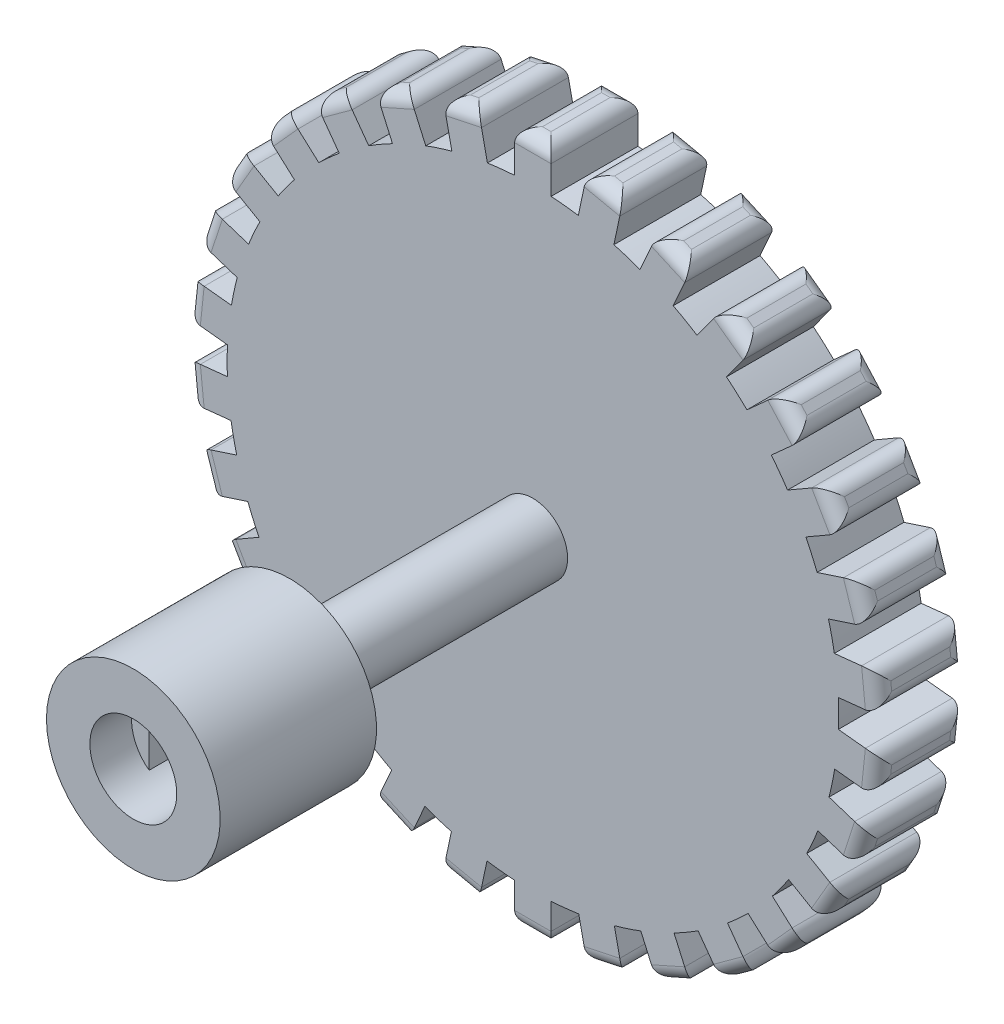
from build123d import *

# Parameters (mm, degrees)
SKETCH1_R                = 88
BOSS_EXTRUDE3_DEPTH      = 25
SKETCH4_W                = 10.4719
SKETCH4_H                = 13.351164338
BOSS_EXTRUDE4_DEPTH      = 25
FILLET2_R                = 4
CIRPATTERN1_COUNT        = 30
FILLET2_OF_CIRPATTERN1_R = 4
SKETCH6_R                = 10
BOSS_EXTRUDE5_DEPTH      = 60
BOSS_EXTRUDE6_START      = 10
SKETCH7_R                = 10
BOSS_EXTRUDE6_DEPTH      = 10
SKETCH8_R                = 10
BOSS_EXTRUDE7_DEPTH      = 10
SKETCH9_R                = 10
BOSS_EXTRUDE8_DEPTH      = 25
SKETCH10_R               = 10
BOSS_EXTRUDE9_DEPTH      = 42.5
SKETCH12_R               = 12.5
CUT_EXTRUDE1_DEPTH       = 12
CUT_EXTRUDE2_START       = -55.5
SKETCH13_R               = 10
CUT_EXTRUDE2_DEPTH       = 55.5
SKETCH14_R               = 25
BOSS_EXTRUDE10_DEPTH     = 45
SKETCH15_R               = 12.5
CUT_EXTRUDE3_DEPTH       = 12
CUT_EXTRUDE4_DEPTH       = 30.5
SCALE1_SCALE             = 0.2


with BuildPart() as part:
    # Sketch1 → Boss-Extrude3 (new body)
    with BuildSketch(Plane.XY):
        Circle(SKETCH1_R)
    extrude(amount=BOSS_EXTRUDE3_DEPTH)

    # Sketch4 → Boss-Extrude4 (add)
    with BuildSketch(Plane.XY.offset(25)):
        with Locations((0, 93.324417831)):
            Rectangle(SKETCH4_W, SKETCH4_H)
    boss_extrude4 = extrude(amount=-BOSS_EXTRUDE4_DEPTH)

    # Fillet2
    fillet2_edges = [part.edges().sort_by_distance(p)[0] for p in [
        (5.23595, 100, 12.5),
        (0, 100, 0),
        (-5.23595, 100, 12.5),
        (0, 100, 25),
    ]]
    fillet(fillet2_edges, radius=FILLET2_R)

    # CirPattern1: Boss-Extrude4 ×30 about axis
    cirpattern1_axis = Axis((0, 0.317667884, 0), (0, 0, 1))
    for i in range(1, CIRPATTERN1_COUNT):
        add(boss_extrude4.rotate(cirpattern1_axis, i * 360 / CIRPATTERN1_COUNT))

    # Fillet2 of CirPattern1
    fillet2_of_cirpattern1_edges = [part.edges().sort_by_distance(p)[0] for p in [
        (-15.603590285, 98.910317096, 12.5),
        (-20.725122215, 97.821701879, 0),
        (-25.846654145, 96.733086661, 12.5),
        (-20.725122215, 97.821701879, 25),
        (-35.7611788, 93.511662322, 12.5),
        (-40.544457139, 91.382009596, 0),
        (-45.327735478, 89.252356869, 12.5),
        (-40.544457139, 91.382009596, 25),
        (-54.3558322, 84.039982796, 12.5),
        (-58.591804732, 80.962368605, 0),
        (-62.827777264, 77.884754413, 12.5),
        (-58.591804732, 80.962368605, 25),
        (-70.574874905, 70.909236365, 12.5),
        (-74.078409304, 67.018167216, 0),
        (-77.581943702, 63.127098067, 12.5),
        (-74.078409304, 67.018167216, 25),
        (-83.709456921, 54.693299655, 12.5),
        (-86.327431921, 50.158833942, 0),
        (-88.945406921, 45.624368229, 12.5),
        (-86.327431921, 50.158833942, 25),
        (-93.185533987, 36.100886913, 12.5),
        (-94.803531519, 31.121202547, 0),
        (-96.42152905, 26.14151818, 12.5),
        (-94.803531519, 31.121202547, 25),
        (-98.588956064, 15.944575793, 12.5),
        (-99.136261871, 10.737308875, 0),
        (-99.683567678, 5.530041957, 12.5),
        (-99.136261871, 10.737308875, 25),
        (-99.683567678, -4.894706189, 12.5),
        (-99.136261871, -10.101973107, 0),
        (-98.588956064, -15.309240025, 12.5),
        (-99.136261871, -10.101973107, 25),
        (-96.42152905, -25.506182413, 12.5),
        (-94.803531519, -30.485866779, 0),
        (-93.185533987, -35.465551145, 12.5),
        (-94.803531519, -30.485866779, 25),
        (-88.945406921, -44.989032461, 12.5),
        (-86.327431921, -49.523498174, 0),
        (-83.709456921, -54.057963887, 12.5),
        (-86.327431921, -49.523498174, 25),
        (-77.581943702, -62.491762299, 12.5),
        (-74.078409304, -66.382831448, 0),
        (-70.574874905, -70.273900597, 12.5),
        (-74.078409304, -66.382831448, 25),
        (-62.827777264, -77.249418645, 12.5),
        (-58.591804732, -80.327032837, 0),
        (-54.3558322, -83.404647029, 12.5),
        (-58.591804732, -80.327032837, 25),
        (-45.327735478, -88.617021102, 12.5),
        (-40.544457139, -90.746673828, 0),
        (-35.7611788, -92.876326554, 12.5),
        (-40.544457139, -90.746673828, 25),
        (-25.846654145, -96.097750894, 12.5),
        (-20.725122215, -97.186366111, 0),
        (-15.603590285, -98.274981329, 12.5),
        (-20.725122215, -97.186366111, 25),
        (-5.23595, -99.364664232, 12.5),
        (0, -99.364664232, 0),
        (5.23595, -99.364664232, 12.5),
        (0, -99.364664232, 25),
        (15.603590285, -98.274981329, 12.5),
        (20.725122215, -97.186366111, 0),
        (25.846654145, -96.097750894, 12.5),
        (20.725122215, -97.186366111, 25),
        (35.7611788, -92.876326554, 12.5),
        (40.544457139, -90.746673828, 0),
        (45.327735478, -88.617021102, 12.5),
        (40.544457139, -90.746673828, 25),
        (54.3558322, -83.404647029, 12.5),
        (58.591804732, -80.327032837, 0),
        (62.827777264, -77.249418645, 12.5),
        (58.591804732, -80.327032837, 25),
        (70.574874905, -70.273900597, 12.5),
        (74.078409304, -66.382831448, 0),
        (77.581943702, -62.491762299, 12.5),
        (74.078409304, -66.382831448, 25),
        (83.709456921, -54.057963887, 12.5),
        (86.327431921, -49.523498174, 0),
        (88.945406921, -44.989032461, 12.5),
        (86.327431921, -49.523498174, 25),
        (93.185533987, -35.465551145, 12.5),
        (94.803531519, -30.485866779, 0),
        (96.42152905, -25.506182413, 12.5),
        (94.803531519, -30.485866779, 25),
        (98.588956064, -15.309240025, 12.5),
        (99.136261871, -10.101973107, 0),
        (99.683567678, -4.894706189, 12.5),
        (99.136261871, -10.101973107, 25),
        (99.683567678, 5.530041957, 12.5),
        (99.136261871, 10.737308875, 0),
        (98.588956064, 15.944575793, 12.5),
        (99.136261871, 10.737308875, 25),
        (96.42152905, 26.14151818, 12.5),
        (94.803531519, 31.121202547, 0),
        (93.185533987, 36.100886913, 12.5),
        (94.803531519, 31.121202547, 25),
        (88.945406921, 45.624368229, 12.5),
        (86.327431921, 50.158833942, 0),
        (83.709456921, 54.693299655, 12.5),
        (86.327431921, 50.158833942, 25),
        (77.581943702, 63.127098067, 12.5),
        (74.078409304, 67.018167216, 0),
        (70.574874905, 70.909236365, 12.5),
        (74.078409304, 67.018167216, 25),
        (62.827777264, 77.884754413, 12.5),
        (58.591804732, 80.962368605, 0),
        (54.3558322, 84.039982796, 12.5),
        (58.591804732, 80.962368605, 25),
        (45.327735478, 89.252356869, 12.5),
        (40.544457139, 91.382009596, 0),
        (35.7611788, 93.511662322, 12.5),
        (40.544457139, 91.382009596, 25),
        (25.846654145, 96.733086661, 12.5),
        (20.725122215, 97.821701879, 0),
        (15.603590285, 98.910317096, 12.5),
        (20.725122215, 97.821701879, 25),
    ]]
    fillet(fillet2_of_cirpattern1_edges, radius=FILLET2_OF_CIRPATTERN1_R)

    # Sketch6 → Boss-Extrude5 (add)
    with BuildSketch(Plane.XY.offset(25)):
        Circle(SKETCH6_R)
    extrude(amount=BOSS_EXTRUDE5_DEPTH)

    # Sketch7 → Boss-Extrude6 (add)
    with BuildSketch(Plane(origin=(0, 0, 0), x_dir=(-1, 0, 0), z_dir=(0, 0, -1)).offset(BOSS_EXTRUDE6_START)):
        with Locations(Location((0, 0, 0), (0, 0, 180))):
            Circle(SKETCH7_R)
    extrude(amount=-BOSS_EXTRUDE6_DEPTH)

    # Sketch8 → Boss-Extrude7 (add)
    with BuildSketch(Plane.XY.offset(85)):
        Circle(SKETCH8_R)
    extrude(amount=BOSS_EXTRUDE7_DEPTH)

    # Sketch9 → Boss-Extrude8 (add)
    with BuildSketch(Plane.XY.offset(95)):
        Circle(SKETCH9_R)
    extrude(amount=BOSS_EXTRUDE8_DEPTH)

    # Sketch10 → Boss-Extrude9 (add)
    with BuildSketch(Plane.XY.offset(120)):
        Circle(SKETCH10_R)
    extrude(amount=BOSS_EXTRUDE9_DEPTH)

    # Sketch12 → Cut-Extrude1 (cut)
    with BuildSketch(Plane.XY.offset(162.5)):
        Circle(SKETCH12_R)
    extrude(amount=-CUT_EXTRUDE1_DEPTH, mode=Mode.SUBTRACT)

    # Sketch13 → Cut-Extrude2 (cut)
    with BuildSketch(Plane.XY.offset(150.5).offset(CUT_EXTRUDE2_START)):
        Circle(SKETCH13_R)
    extrude(amount=CUT_EXTRUDE2_DEPTH, mode=Mode.SUBTRACT)

    # Sketch14 → Boss-Extrude10 (add)
    with BuildSketch(Plane.XY.offset(95)):
        with Locations(Location((0, 0, 0), (0, 0, 180))):
            Circle(SKETCH14_R)
    extrude(amount=BOSS_EXTRUDE10_DEPTH)

    # Sketch15 → Cut-Extrude3 (cut)
    with BuildSketch(Plane.XY.offset(140)):
        Circle(SKETCH15_R)
    extrude(amount=-CUT_EXTRUDE3_DEPTH, mode=Mode.SUBTRACT)

    # Sketch16 → Cut-Extrude4 (cut)
    with BuildSketch(Plane.XY.offset(128)):
        with BuildLine():
            Line((7.45, -10.037305415), (7.45, 10.037305415))
            ThreePointArc((7.45, 10.037305415), (0, 12.5), (-7.45, 10.037305415))
            Line((-7.45, 10.037305415), (-7.45, -10.037305415))
            ThreePointArc((-7.45, -10.037305415), (0, -12.5), (7.45, -10.037305415))
        make_face()
    extrude(amount=-CUT_EXTRUDE4_DEPTH, mode=Mode.SUBTRACT)


with BuildPart() as part_1:
    # Scale1: scaled about (1e-09, 0.17329186, 23.229025496)
    add(part.part.scale(SCALE1_SCALE).moved(Location((1e-09, 0.138633488, 18.583220397))))


solid = part_1.part
